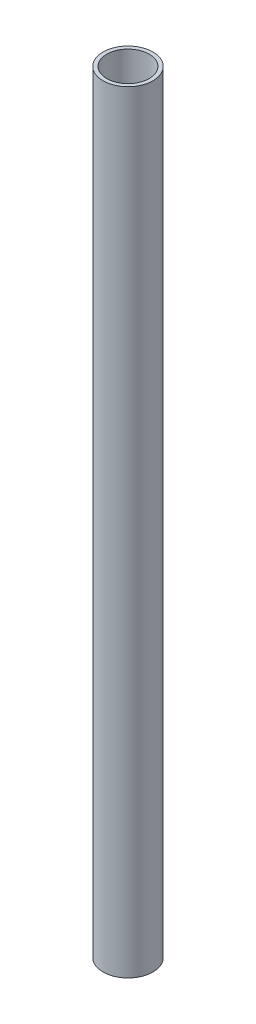
from build123d import *

# Parameters (mm, degrees)
SKETCH1_R           = 20
SKETCH1_R_2         = 17
BOSS_EXTRUDE1_DEPTH = 619


with BuildPart() as part:
    # Sketch1 → Boss-Extrude1 (new body)
    with BuildSketch(Plane(origin=(0, 0, 0), x_dir=(1, 0, 0), z_dir=(0, 1, 0))):
        with Locations(Location((0, 0, 0), (0, 0, 270))):
            Circle(SKETCH1_R)
        with Locations(Location((0, 0, 0), (0, 0, 270))):
            Circle(SKETCH1_R_2, mode=Mode.SUBTRACT)
    extrude(amount=BOSS_EXTRUDE1_DEPTH)


solid = part.part
